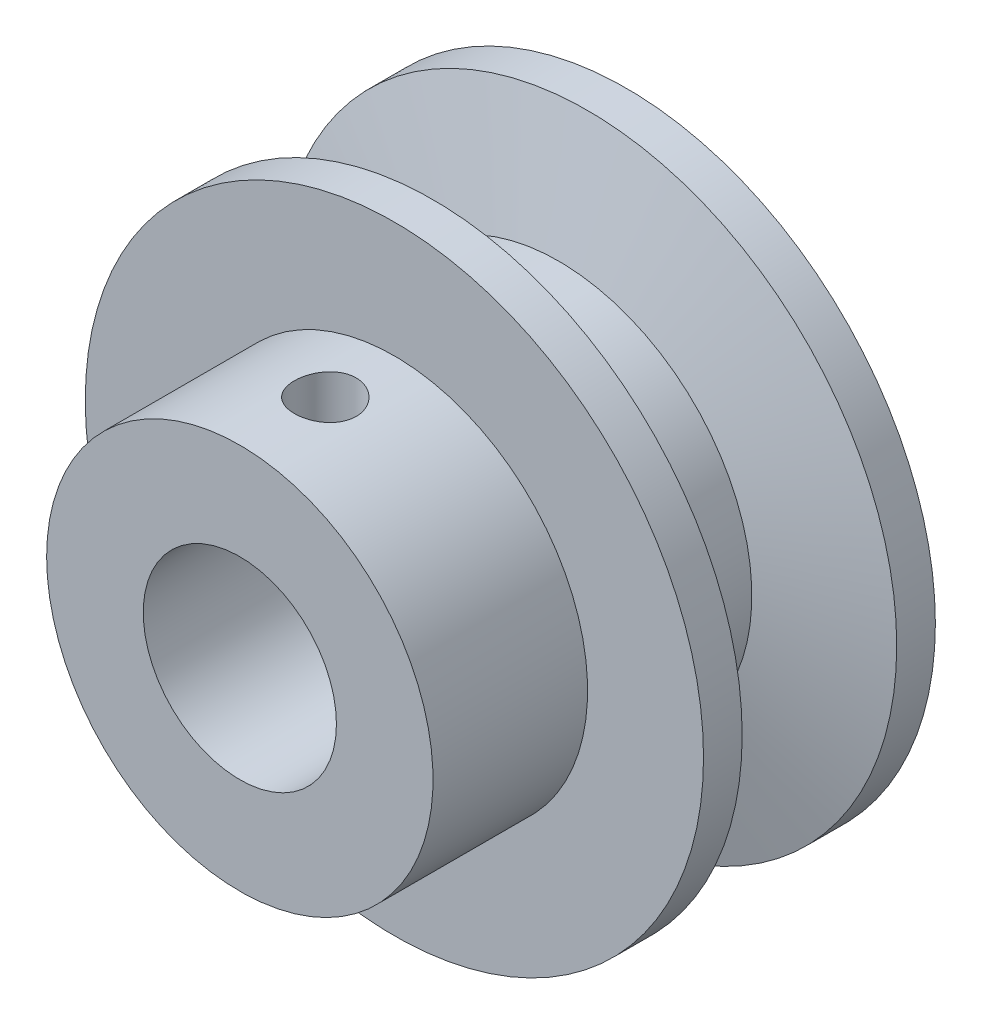
from build123d import *

# Parameters (mm, degrees)
SKETCH2_R          = 12.5
CUT_EXTRUDE1_DEPTH = 70
SKETCH5_R          = 4
CUT_EXTRUDE2_DEPTH = 27


with BuildPart() as part:
    # Sketch1 → Revolve1 (revolve)
    with BuildSketch(Plane(origin=(0, 0, 0), x_dir=(1, 0, 0), z_dir=(0, 1, 0)), mode=Mode.PRIVATE) as revolve1_sk:
        Polygon((0, 24.303944316), (40, 24.303944316), (40, 19.303944316), (25, 15.553944316), (25, 3.053944316), (40, -0.696055684), (40, -5.696055684), (25, -5.696055684), (25, -25.696055684), (0, -25.696055684), align=None)
    revolve(revolve1_sk.sketch.rotate(Axis((0, 0, -24.303944316), (0, 0, 1)), 180), axis=Axis((0, 0, -24.303944316), (0, 0, 1)))

    # Sketch2 → Cut-Extrude1 (cut)
    with BuildSketch(Plane.XY.offset(25.696055684)):
        Circle(SKETCH2_R)
    extrude(amount=-CUT_EXTRUDE1_DEPTH, mode=Mode.SUBTRACT)

    # Sketch5 → Cut-Extrude2 (cut)
    with BuildSketch(Plane(origin=(0, 25, 25.696055684), x_dir=(1, 0, 0), z_dir=(0, 1, 0))):
        with Locations(Location((0, 11.058273662, 0), (0, 0, 180))):
            Circle(SKETCH5_R)
    extrude(amount=-CUT_EXTRUDE2_DEPTH, mode=Mode.SUBTRACT)


solid = part.part
